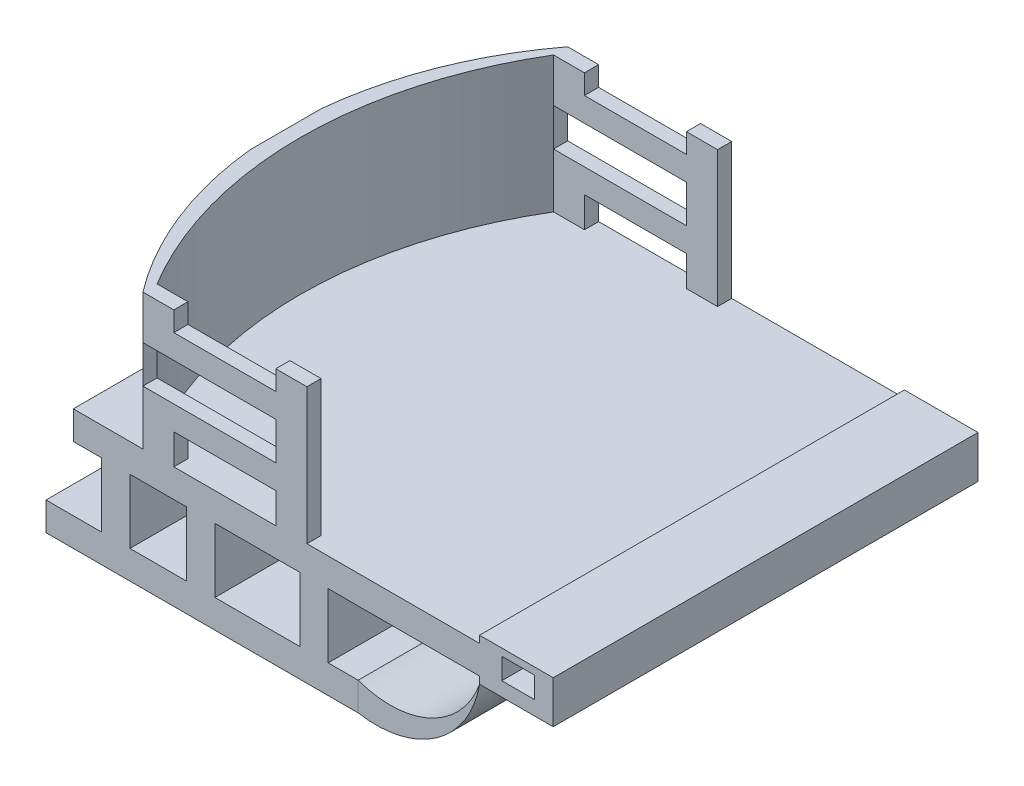
from build123d import *

# Parameters (mm, degrees)
BOSS_EXTRUDE4_DEPTH  = 150
SKETCH4_W            = 134.576159563
SKETCH4_H            = 10
BOSS_EXTRUDE5_DEPTH  = 150
SKETCH6_W            = 11.616097845
SKETCH6_H            = 7.5
CUT_EXTRUDE2_DEPTH   = 150
SKETCH9_W            = 24.346346268
SKETCH9_H            = 10
CUT_EXTRUDE3_DEPTH   = 150
BOSS_EXTRUDE8_DEPTH  = 150
SKETCH11_W           = 140
SKETCH11_H           = 48
CUT_EXTRUDE5_DEPTH   = 150
SKETCH12_W           = 57.917424305
SKETCH12_H           = 8.499583788
SKETCH12_H_2         = 8.499583789
BOSS_EXTRUDE9_DEPTH  = 150
SKETCH13_W           = 140
SKETCH13_H           = 30.315182179
CUT_EXTRUDE6_DEPTH   = 150
BOSS_EXTRUDE10_DEPTH = 48
SKETCH17_W           = 10.917424305
SKETCH17_H           = 13.316014602
CUT_EXTRUDE7_DEPTH   = 150


with BuildPart() as part:
    # Sketch1 → Boss-Extrude4 (new body)
    with BuildSketch(Plane.XY):
        Polygon((-25.917424305, 7.5), (-50.5, 7.5), (-50.5, -2.5), (-40.5, -2.5), (-40.5, -27.5), (-30.5, -27.5), (-30.5, -2.5), (-10.5, -2.5), (-10.5, -27.5), (-0.5, -27.5), (-0.5, -2.5), (29.5, -2.5), (29.5, -27.5), (39.5, -27.5), (39.5, -2.5), (92.961651585, -2.5), (92.961651585, -5), (118.961651585, -5), (118.961651585, 10), (92.961651585, 10), (92.961651585, 7.5), (32, 7.5), (32, 55.5), (21, 55.5), (21, 7.5), (-15, 7.5), (-15, 55.5), (-25.917424305, 55.5), align=None)
    extrude(amount=BOSS_EXTRUDE4_DEPTH)

    # Sketch4 → Boss-Extrude5 (add)
    with BuildSketch(Plane.XY.offset(150)):
        with Locations((7.154745881, -30.19267984)):
            Rectangle(SKETCH4_W, SKETCH4_H)
    extrude(amount=-BOSS_EXTRUDE5_DEPTH)

    # Sketch6 → Cut-Extrude2 (cut)
    with BuildSketch(Plane.XY.offset(150)):
        with Locations((106.618711588, 3.75)):
            Rectangle(SKETCH6_W, SKETCH6_H)
    extrude(amount=-CUT_EXTRUDE2_DEPTH, mode=Mode.SUBTRACT)

    # Sketch9 → Cut-Extrude3 (cut)
    with BuildSketch(Plane.XY.offset(150)):
        with Locations((62.269652528, -30.19267984)):
            Rectangle(SKETCH9_W, SKETCH9_H)
    extrude(amount=-CUT_EXTRUDE3_DEPTH, mode=Mode.SUBTRACT)

    # Sketch11 → Cut-Extrude5 (cut)
    with BuildSketch(Plane(origin=(32, 0, 0), x_dir=(0, 0, -1), z_dir=(1, 0, 0))):
        with Locations((-75, 31.5)):
            Rectangle(SKETCH11_W, SKETCH11_H)
    extrude(amount=-CUT_EXTRUDE5_DEPTH, mode=Mode.SUBTRACT)

    # Sketch12 → Boss-Extrude9 (add)
    with BuildSketch(Plane.XY.offset(150)):
        with Locations((3.041287847, 44.304242043)):
            Rectangle(SKETCH12_W, SKETCH12_H)
        with Locations((3.041287847, 22.488643653)):
            Rectangle(SKETCH12_W, SKETCH12_H_2)
    extrude(amount=-BOSS_EXTRUDE9_DEPTH)

    # Sketch13 → Cut-Extrude6 (cut)
    with BuildSketch(Plane(origin=(32, 0, 0), x_dir=(0, 0, -1), z_dir=(1, 0, 0))):
        with Locations((-75, 33.396442847)):
            Rectangle(SKETCH13_W, SKETCH13_H)
    extrude(amount=-CUT_EXTRUDE6_DEPTH, mode=Mode.SUBTRACT)

    # Sketch16 → Boss-Extrude10 (add)
    with BuildSketch(Plane(origin=(0, 7.5, 0), x_dir=(1, 0, 0), z_dir=(0, 1, 0))):
        with BuildLine():
            Line((-25.917424305, -150), (-25.917424305, -145))
            ThreePointArc((-25.917424305, -145), (-45.385865108, -75), (-25.917424305, -5))
            Line((-25.917424305, -5), (-25.917424305, 0))
            ThreePointArc((-25.917424305, 0), (-42.506880721, -29.52217094), (-50.5, -62.429293047))
            Line((-50.5, -62.429293047), (-50.5, -87.570706953))
            ThreePointArc((-50.5, -87.570706953), (-42.506880721, -120.47782906), (-25.917424305, -150))
        make_face()
    extrude(amount=BOSS_EXTRUDE10_DEPTH)

    # Sketch17 → Cut-Extrude7 (cut)
    with BuildSketch(Plane.XY.offset(150)):
        with Locations((-20.458712153, 33.396442848)):
            Rectangle(SKETCH17_W, SKETCH17_H)
    extrude(amount=-CUT_EXTRUDE7_DEPTH, mode=Mode.SUBTRACT)


with BuildPart() as body_2:
    # Sketch10 → Boss-Extrude8 (new body)
    with BuildSketch(Plane.XY.offset(150)):
        with BuildLine():
            Line((50.096479394, -35.19267984), (50.096479394, -25.19267984))
            ThreePointArc((50.096479394, -25.19267984), (75.711106415, -23.974007757), (92.961651585, -5))
            ThreePointArc((92.961651585, -5), (77.782174226, -28.974007757), (50.096479394, -35.19267984))
        make_face()
    extrude(amount=-BOSS_EXTRUDE8_DEPTH)


solid = Compound([part.part, body_2.part])
